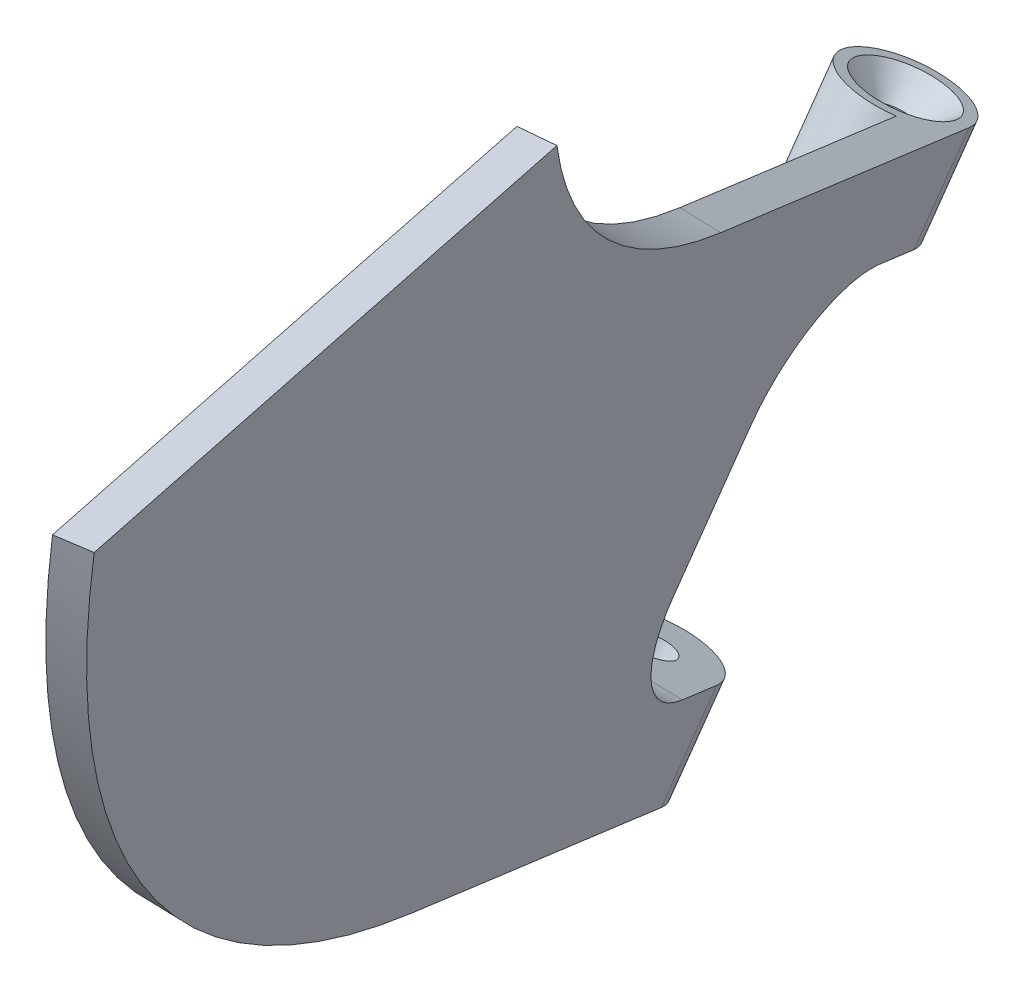
from build123d import *

# Parameters (mm, degrees)
BOSS_EXTRUDE1_DEPTH = 5
CUT_EXTRUDE1_DEPTH  = 152.149714479
BOSS_EXTRUDE2_DEPTH = 1.6
CUT_EXTRUDE2_REACH  = 101.053
FILLET1_R           = 5
SKETCH8_R           = 0.9
CUT_EXTRUDE3_DEPTH  = 175.947714489
CHAMFER1_SIZE       = 1.1


with BuildPart() as part:
    # Sketch3 → Boss-Extrude1 (new body)
    with BuildSketch(Plane(origin=(0, 0, 0), x_dir=(-1, 0, 0), z_dir=(0, 0.40673664307580104, 0.9135454576426005))):
        Polygon((-142.43706784, 45.295200471), (-137.485727496, 44.599334966), (-141.048558881, 19.248472407), (-145.999899225, 19.944337911), align=None)
    extrude(amount=-BOSS_EXTRUDE1_DEPTH)

    # Sketch4 → Cut-Extrude1 (cut, through all)
    with BuildSketch(Plane(origin=(-3.483639423, -22.644400664, 10.081936737), x_dir=(0.9902680687415713, -0.12714095420809696, 0.056606799890943936), z_dir=(-0.13917310096005903, -0.9046548960473729, 0.4027783100251033))):
        with BuildLine():
            Line((146.507886552, 0), (144.854753595, 0))
            ThreePointArc((144.854753595, 0), (145.65008791, -0.129885377), (146.362780386, -0.506045337))
            Line((146.362780386, -0.506045337), (146.507886552, 0))
        make_face()
        with BuildLine():
            Line((142.354753595, 0), (142.354753595, -2.5))
            ThreePointArc((142.354753595, -2.5), (143.086986642, -0.732233047), (144.854753595, 0))
            Line((144.854753595, 0), (142.354753595, 0))
        make_face()
        with BuildLine():
            Line((142.354753595, -5), (144.854753595, -5))
            ThreePointArc((144.854753595, -5), (143.086986642, -4.267766953), (142.354753595, -2.5))
            Line((142.354753595, -2.5), (142.354753595, -5))
        make_face()
        with BuildLine():
            Line((147.354753595, -5), (147.354753595, -2.851352087))
            Line((147.354753595, -2.851352087), (147.257907835, -3.18909339))
            ThreePointArc((147.257907835, -3.18909339), (146.359291153, -4.496588775), (144.854753595, -5))
            Line((144.854753595, -5), (147.354753595, -5))
        make_face()
    extrude(amount=-CUT_EXTRUDE1_DEPTH, mode=Mode.SUBTRACT)

    # 3DSketch1 → Boss-Extrude2 (add)
    with BuildSketch(Plane(origin=(145.903995961, -19.504867382, 5.193229142), x_dir=(0.26692941591244046, 0.317996421638383, 0.9097400522928664), z_dir=(-0.9519067631920917, 0.23432754207656112, 0.1973933058984336))):
        with BuildLine():
            Line((0, 0), (18.020194743, 0.750238039))
            ThreePointArc((18.020194743, 0.750238039), (27.757448286, 3.045703126), (35.949753791, 8.787601507))
            Line((35.949753791, 8.787601507), (61.336751154, 0))
            ThreePointArc((61.336751154, 0), (43.312353527, -17.691834348), (19.085081694, -24.827604243))
            Line((19.085081694, -24.827604243), (1.064886951, -25.577842282))
            Line((1.064886951, -25.577842282), (0, 0))
        make_face()
    extrude(amount=BOSS_EXTRUDE2_DEPTH)

    # SurfaceCut1
    split(bisect_by=Plane(origin=(0, 0, 0), x_dir=(1, 0, 0), z_dir=(0, 1, 0)), keep=Keep.BOTTOM)

    # Sketch7 → Cut-Extrude2 (cut, up to next)
    with BuildSketch(Plane(origin=(135.582383415, -33.375838772, -28.115206151), x_dir=(-0.1909616440160216, 0.05006214034989929, -0.9803200664162116), z_dir=(0.9519067631921003, -0.23432754207656978, -0.197393305898382)), mode=Mode.PRIVATE) as cut_extrude2_sk1:
        Polygon((-42.660506239, 14.950285755), (-33.555755259, 10.814646797), (-40.338203151, -4.11714481), (-49.44295413, 0.018494148), align=None)
    cut_extrude2_tool1 = extrude(cut_extrude2_sk1.sketch, amount=-CUT_EXTRUDE2_REACH, mode=Mode.PRIVATE) & part.part
    add(cut_extrude2_tool1.solids().sort_by_distance((144.804967, -30.194611, 12.58319))[0], mode=Mode.SUBTRACT)

    # Fillet1
    fillet1_edges = [part.edges().sort_by_distance(p)[0] for p in [
        (146.549435826, -20.809301178, 13.907118047),
        (144.26699697, -35.645641474, 20.512682331),
    ]]
    fillet(fillet1_edges, radius=FILLET1_R)

    # Sketch8 → Cut-Extrude3 (cut, through all)
    with BuildSketch(Plane(origin=(-3.483639423, -22.644400664, 10.081936737), x_dir=(-0.9902680687415713, 0.12714095420809696, -0.056606799890943936), z_dir=(-0.13917310096005903, -0.9046548960473729, 0.4027783100251033))):
        with Locations(Location((-144.854753595, 2.5, 0), (0, 0, 90))):
            Circle(SKETCH8_R)
    extrude(amount=-CUT_EXTRUDE3_DEPTH, mode=Mode.SUBTRACT)

    # Chamfer1
    chamfer1_edges = [part.edges().sort_by_distance(p)[0] for p in [
        (143.524229053, -18.552985548, 6.508903318),
        (139.961397668, -41.712150887, 16.820028055),
    ]]
    chamfer(chamfer1_edges, length=CHAMFER1_SIZE)


solid = part.part
